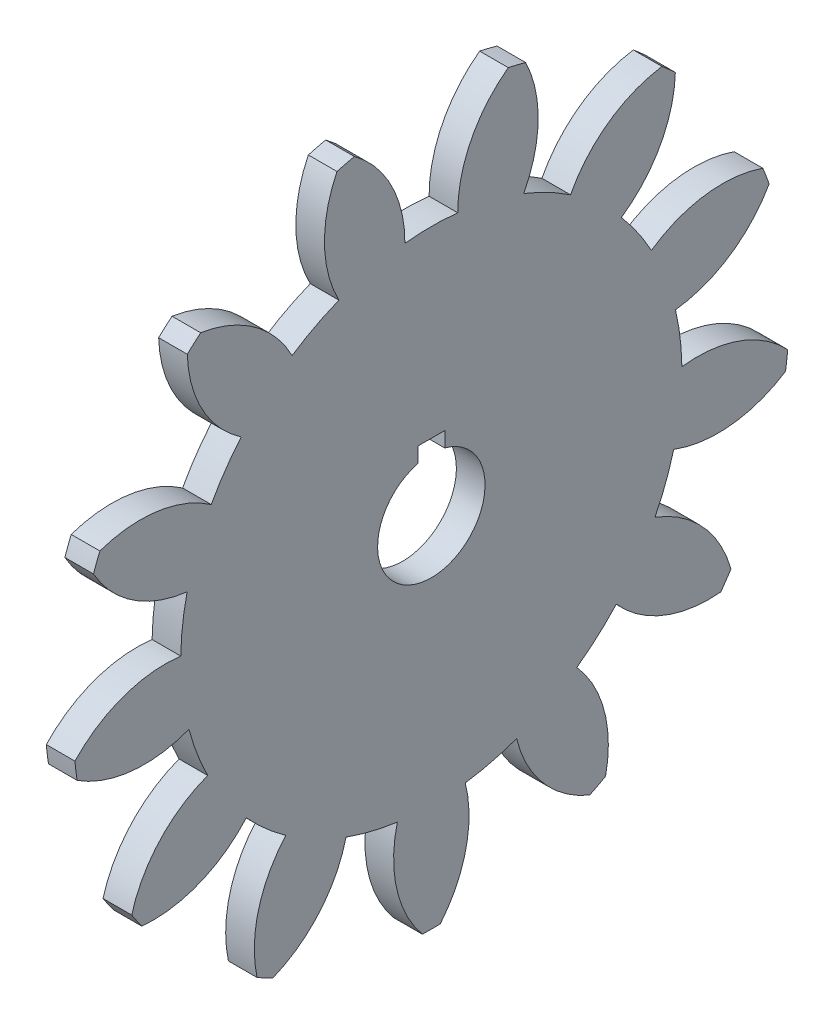
from build123d import *

# Parameters (mm, degrees)
BASPROSKE_W     = 2.54
BASPROSKE_H     = 31.75
TOOTHCUT_DEPTH  = 45.973065272
TEETHCUTS_COUNT = 13
TEETHCUTS_ANGLE = 332.307692308
BORSKE_R        = 4.7625
BORE_DEPTH      = 50.8000508
KEYSKE_W        = 2.38252
KEYSKE_H        = 5.95376
KEYWAY_DEPTH    = 50.8000508


with BuildPart() as part:
    # BasProSke → Base-Revolve (revolve)
    with BuildSketch(Plane(origin=(0, 0, 0), x_dir=(1, 0, 0), z_dir=(0, 1, 0)), mode=Mode.PRIVATE) as base_revolve_sk:
        with Locations((1.27, 15.875)):
            Rectangle(BASPROSKE_W, BASPROSKE_H)
    revolve(base_revolve_sk.sketch.rotate(Axis((-10, 0, 0), (1, 0, 0)), 180), axis=Axis((-10, 0, 0), (1, 0, 0)))

    # TooCutSke → ToothCut (cut, through all)
    with BuildSketch(Plane(origin=(0, 0, 0), x_dir=(0, 0, -1), z_dir=(1, 0, 0))):
        with BuildLine():
            ThreePointArc((2.343562174, 22.099816548), (0, 22.22373), (-2.343562174, 22.099816548))
            ThreePointArc((-2.343562174, 22.099816548), (-3.525013683, 27.105489309), (-6.851797785, 31.027873151))
            ThreePointArc((-6.851797785, 31.027873151), (0, 31.7754), (6.851797785, 31.027873151))
            ThreePointArc((6.851797785, 31.027873151), (3.525013683, 27.105489309), (2.343562174, 22.099816548))
        make_face()
    toothcut = extrude(amount=TOOTHCUT_DEPTH, mode=Mode.SUBTRACT)

    # TeethCuts: ToothCut ×13 about axis
    teethcuts_axis = Axis((-10, 0, 0), (1, 0, 0))
    for i in range(1, TEETHCUTS_COUNT):
        add(toothcut.rotate(teethcuts_axis, i * TEETHCUTS_ANGLE / (TEETHCUTS_COUNT - 1)), mode=Mode.SUBTRACT)

    # BorSke → Bore (cut, symmetric)
    with BuildSketch(Plane(origin=(0, 0, 0), x_dir=(0, 0, -1), z_dir=(1, 0, 0))):
        with Locations(Location((0, 0, 0), (0, 0, 180))):
            Circle(BORSKE_R)
    extrude(amount=BORE_DEPTH, both=True, mode=Mode.SUBTRACT)

    # KeySke → Keyway (cut, symmetric)
    with BuildSketch(Plane(origin=(0, 0, 0), x_dir=(0, 0, -1), z_dir=(1, 0, 0))):
        with Locations((0, 2.97688)):
            Rectangle(KEYSKE_W, KEYSKE_H)
    extrude(amount=KEYWAY_DEPTH, both=True, mode=Mode.SUBTRACT)


solid = part.part
